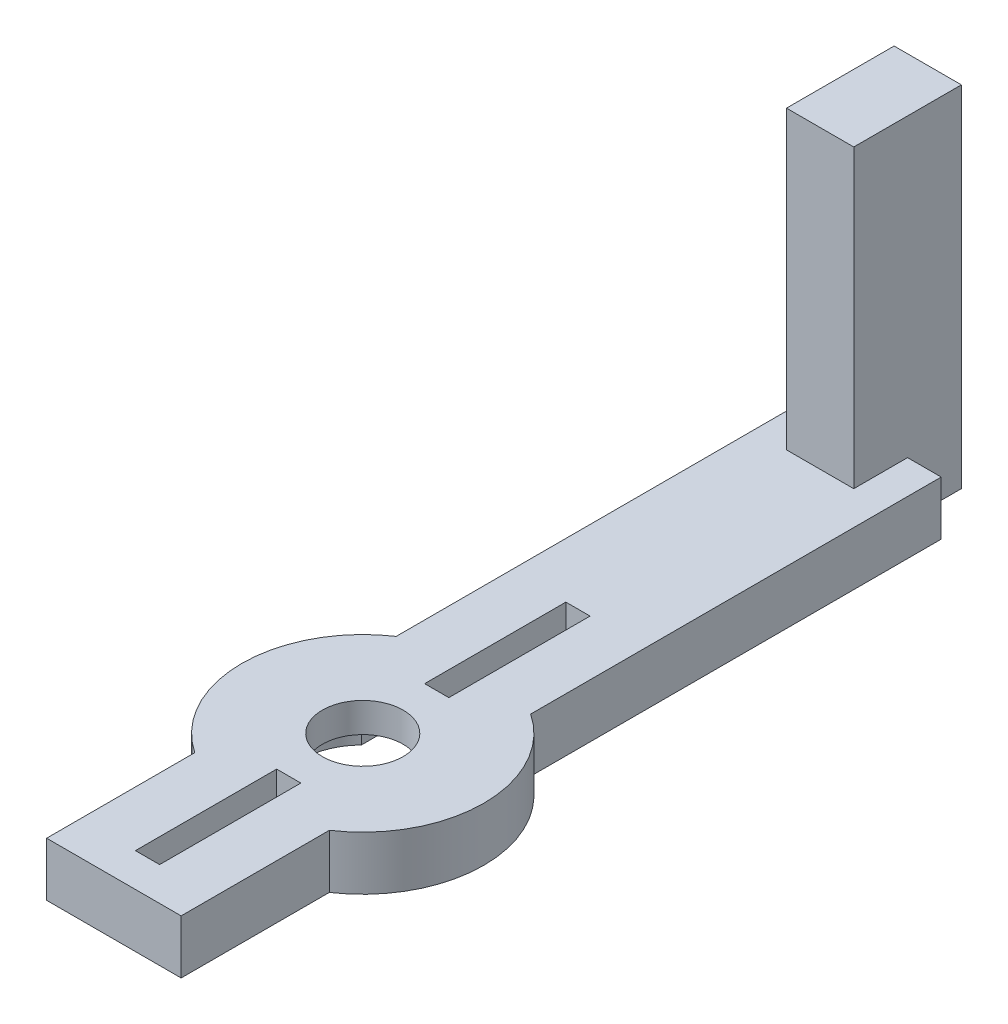
from build123d import *

# Parameters (mm, degrees)
BOSS_EXTRUDE1_START = 63.6
SKETCH1_R           = 9
BOSS_EXTRUDE1_DEPTH = 4
BOSS_EXTRUDE2_START = -100
SKETCH2_W           = 10
SKETCH2_H           = 4
BOSS_EXTRUDE2_DEPTH = 56.5
BOSS_EXTRUDE3_START = -104
SKETCH3_W           = 5
SKETCH3_H           = 26
BOSS_EXTRUDE3_DEPTH = 8
BOSS_EXTRUDE4_START = 63.1
SKETCH4_R           = 4.6
BOSS_EXTRUDE4_DEPTH = 2.3
BOSS_EXTRUDE5_START = -62
SKETCH5_W           = 6.6
SKETCH5_H           = 2.3
BOSS_EXTRUDE5_DEPTH = 17.5
BOSS_EXTRUDE6_START = -56.5
SKETCH6_W           = 1.8
SKETCH6_H           = 6
BOSS_EXTRUDE6_DEPTH = 10.5
BOSS_EXTRUDE7_START = -79.5
SKETCH7_W           = 6.6
SKETCH7_H           = 2.3
BOSS_EXTRUDE7_DEPTH = 17.5
BOSS_EXTRUDE8_START = -78
SKETCH8_W           = 1.8
SKETCH8_H           = 6
BOSS_EXTRUDE8_DEPTH = 10.5
BOSS_EXTRUDE9_START = 62.6
SKETCH9_R           = 3
BOSS_EXTRUDE9_DEPTH = 6


with BuildPart() as part:
    # Sketch1 → Boss-Extrude1 (new body)
    with BuildSketch(Plane(origin=(0, 0, 0), x_dir=(1, 0, 0), z_dir=(0, 1, 0)).offset(BOSS_EXTRUDE1_START)):
        with Locations(Location((0, 62, 0), (0, 0, 270))):
            Circle(SKETCH1_R)
    extrude(amount=BOSS_EXTRUDE1_DEPTH)

    # Sketch2 → Boss-Extrude2 (add)
    with BuildSketch(Plane.XY.offset(BOSS_EXTRUDE2_START)):
        with Locations((0, 65.6)):
            Rectangle(SKETCH2_W, SKETCH2_H)
    extrude(amount=BOSS_EXTRUDE2_DEPTH)

    # Sketch3 → Boss-Extrude3 (add)
    with BuildSketch(Plane.XY.offset(BOSS_EXTRUDE3_START)):
        with Locations((0, 76.6)):
            Rectangle(SKETCH3_W, SKETCH3_H)
    extrude(amount=BOSS_EXTRUDE3_DEPTH)


with BuildPart() as body_2:
    # Sketch4 → Boss-Extrude4 (new body)
    with BuildSketch(Plane(origin=(0, 0, 0), x_dir=(1, 0, 0), z_dir=(0, 1, 0)).offset(BOSS_EXTRUDE4_START)):
        with Locations(Location((0, 62, 0), (0, 0, 270))):
            Circle(SKETCH4_R)
    extrude(amount=BOSS_EXTRUDE4_DEPTH)


with BuildPart() as part_1:
    add(part.part)

    # Combine1: cut body 2
    add(body_2.part, mode=Mode.SUBTRACT)


with BuildPart() as body_2_2:
    # Sketch5 → Boss-Extrude5 (new body)
    with BuildSketch(Plane.XY.offset(BOSS_EXTRUDE5_START)):
        with Locations((0, 64.25)):
            Rectangle(SKETCH5_W, SKETCH5_H)
    extrude(amount=BOSS_EXTRUDE5_DEPTH)


with BuildPart() as part_2:
    add(part_1.part)

    # Combine2: cut body 2 2
    add(body_2_2.part, mode=Mode.SUBTRACT)


with BuildPart() as body_2_3:
    # Sketch6 → Boss-Extrude6 (new body)
    with BuildSketch(Plane.XY.offset(BOSS_EXTRUDE6_START)):
        with Locations((0, 65.6)):
            Rectangle(SKETCH6_W, SKETCH6_H)
    extrude(amount=BOSS_EXTRUDE6_DEPTH)


with BuildPart() as part_3:
    add(part_2.part)

    # Combine3: cut body 2 3
    add(body_2_3.part, mode=Mode.SUBTRACT)


with BuildPart() as body_2_4:
    # Sketch7 → Boss-Extrude7 (new body)
    with BuildSketch(Plane.XY.offset(BOSS_EXTRUDE7_START)):
        with Locations((0, 64.25)):
            Rectangle(SKETCH7_W, SKETCH7_H)
    extrude(amount=BOSS_EXTRUDE7_DEPTH)


with BuildPart() as part_4:
    add(part_3.part)

    # Combine4: cut body 2 4
    add(body_2_4.part, mode=Mode.SUBTRACT)


with BuildPart() as body_2_5:
    # Sketch8 → Boss-Extrude8 (new body)
    with BuildSketch(Plane.XY.offset(BOSS_EXTRUDE8_START)):
        with Locations((0, 65.6)):
            Rectangle(SKETCH8_W, SKETCH8_H)
    extrude(amount=BOSS_EXTRUDE8_DEPTH)


with BuildPart() as part_5:
    add(part_4.part)

    # Combine5: cut body 2 5
    add(body_2_5.part, mode=Mode.SUBTRACT)


with BuildPart() as body_2_6:
    # Sketch9 → Boss-Extrude9 (new body)
    with BuildSketch(Plane(origin=(0, 0, 0), x_dir=(1, 0, 0), z_dir=(0, 1, 0)).offset(BOSS_EXTRUDE9_START)):
        with Locations(Location((0, 62, 0), (0, 0, 270))):
            Circle(SKETCH9_R)
    extrude(amount=BOSS_EXTRUDE9_DEPTH)


with BuildPart() as part_6:
    add(part_5.part)

    # Combine6: cut body 2 6
    add(body_2_6.part, mode=Mode.SUBTRACT)


solid = part_6.part
